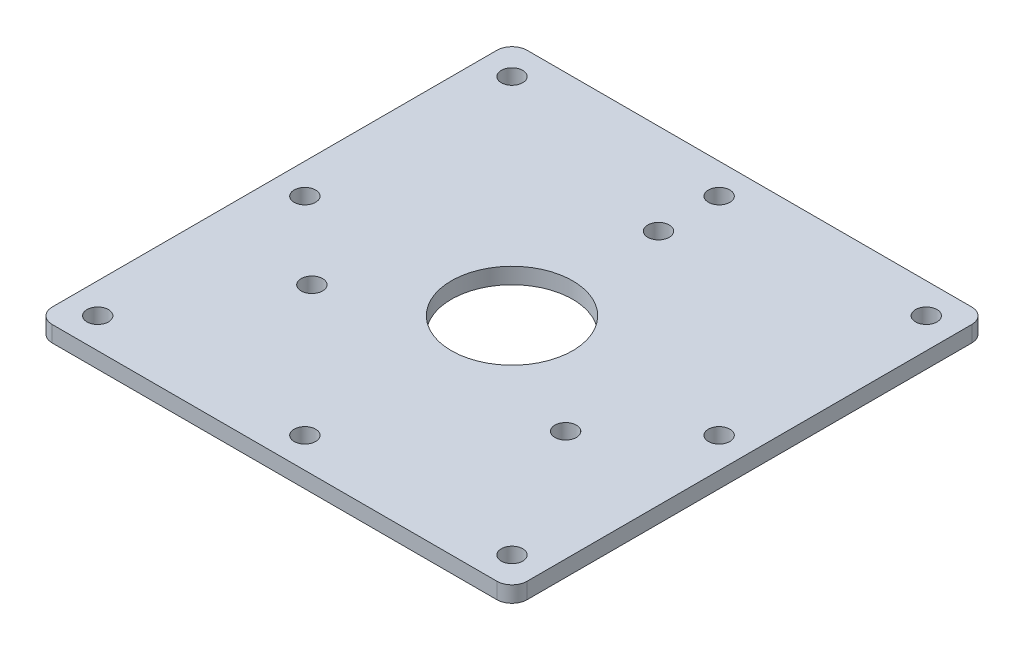
from build123d import *

# Parameters (mm, degrees)
SKETCH1_W           = 94
SKETCH1_H           = 94
SKETCH1_R           = 12
SKETCH1_R_2         = 2.125
BOSS_EXTRUDE1_DEPTH = 3.175
FILLET1_R           = 3


with BuildPart() as part:
    # Sketch1 → Boss-Extrude1 (new body)
    with BuildSketch(Plane(origin=(0, 0, 0), x_dir=(1, 0, 0), z_dir=(0, 1, 0))):
        Rectangle(SKETCH1_W, SKETCH1_H)
        with Locations(Location((0, 0, 0), (0, 0, 270))):
            Circle(SKETCH1_R, mode=Mode.SUBTRACT)
        with Locations(Location((0, 29, 0), (0, 0, 270))):
            Circle(SKETCH1_R_2, mode=Mode.SUBTRACT)
        with Locations(Location((25.11473671, -14.5, 0), (0, 0, 270))):
            Circle(SKETCH1_R_2, mode=Mode.SUBTRACT)
        with Locations(Location((-25.11473671, -14.5, 0), (0, 0, 270))):
            Circle(SKETCH1_R_2, mode=Mode.SUBTRACT)
        with Locations(Location((-41, -41, 0), (0, 0, 270))):
            Circle(SKETCH1_R_2, mode=Mode.SUBTRACT)
        with Locations(Location((-41, 0, 0), (0, 0, 270))):
            Circle(SKETCH1_R_2, mode=Mode.SUBTRACT)
        with Locations(Location((-41, 41, 0), (0, 0, 90))):
            Circle(SKETCH1_R_2, mode=Mode.SUBTRACT)
        with Locations(Location((41, -41, 0), (0, 0, 90))):
            Circle(SKETCH1_R_2, mode=Mode.SUBTRACT)
        with Locations(Location((41, 0, 0), (0, 0, 90))):
            Circle(SKETCH1_R_2, mode=Mode.SUBTRACT)
        with Locations(Location((41, 41, 0), (0, 0, 270))):
            Circle(SKETCH1_R_2, mode=Mode.SUBTRACT)
        with Locations(Location((0, -41, 0), (0, 0, 270))):
            Circle(SKETCH1_R_2, mode=Mode.SUBTRACT)
        with Locations(Location((0, 41, 0), (0, 0, 90))):
            Circle(SKETCH1_R_2, mode=Mode.SUBTRACT)
    extrude(amount=BOSS_EXTRUDE1_DEPTH)

    # Fillet1
    fillet1_edges = [part.edges().sort_by_distance(p)[0] for p in [
        (47, 1.5875, 47),
        (-47, 1.5875, 47),
        (-47, 1.5875, -47),
        (47, 1.5875, -47),
    ]]
    fillet(fillet1_edges, radius=FILLET1_R)


solid = part.part
